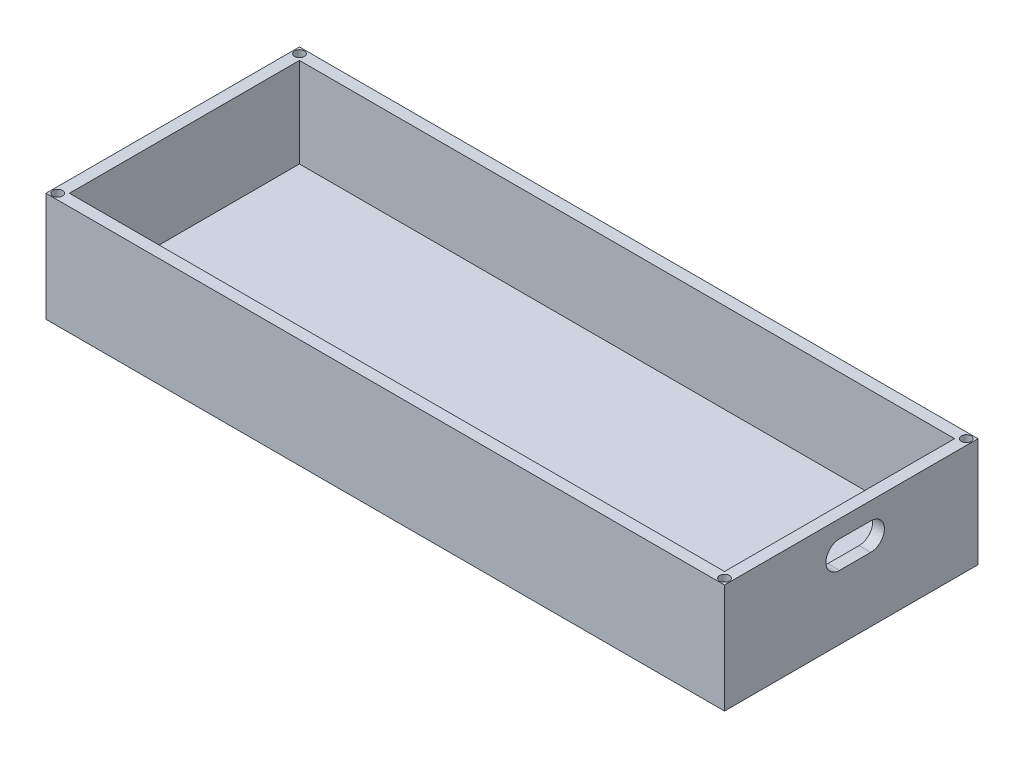
from build123d import *

# Parameters (mm, degrees)
SKETCH1_W           = 174
SKETCH1_H           = 65
BOSS_EXTRUDE1_DEPTH = 5
SKETCH2_W           = 174
SKETCH2_H           = 65
SKETCH2_W_2         = 168
SKETCH2_H_2         = 59
BOSS_EXTRUDE2_DEPTH = 23
CUT_EXTRUDE1_DEPTH  = 23
SKETCH4_R           = 1.25
CUT_EXTRUDE2_DEPTH  = 5


with BuildPart() as part:
    # Sketch1 → Boss-Extrude1 (new body)
    with BuildSketch(Plane(origin=(0, 0, 0), x_dir=(1, 0, 0), z_dir=(0, 1, 0))):
        Rectangle(SKETCH1_W, SKETCH1_H)
    extrude(amount=BOSS_EXTRUDE1_DEPTH)

    # Sketch2 → Boss-Extrude2 (add)
    with BuildSketch(Plane(origin=(0, 5, 0), x_dir=(1, 0, 0), z_dir=(0, 1, 0))):
        Rectangle(SKETCH2_W, SKETCH2_H)
        Rectangle(SKETCH2_W_2, SKETCH2_H_2, mode=Mode.SUBTRACT)
    extrude(amount=BOSS_EXTRUDE2_DEPTH)

    # Sketch3 → Cut-Extrude1 (cut)
    with BuildSketch(Plane(origin=(87, 0, 0), x_dir=(0, 0, -1), z_dir=(1, 0, 0))):
        with BuildLine():
            Line((-3, 23.5), (5, 23.5))
            ThreePointArc((5, 23.5), (8.5, 20), (5, 16.5))
            Line((5, 16.5), (-3, 16.5))
            ThreePointArc((-3, 16.5), (-6.5, 20), (-3, 23.5))
        make_face()
    extrude(amount=-CUT_EXTRUDE1_DEPTH, mode=Mode.SUBTRACT)

    # Sketch4 → Cut-Extrude2 (cut)
    with BuildSketch(Plane(origin=(0, 28, 0), x_dir=(1, 0, 0), z_dir=(0, 1, 0))):
        with Locations(Location((-85.5, 31, 0), (0, 0, 270))):
            Circle(SKETCH4_R)
        with Locations(Location((85.5, 31, 0), (0, 0, 270))):
            Circle(SKETCH4_R)
        with Locations(Location((85.5, -31, 0), (0, 0, 270))):
            Circle(SKETCH4_R)
        with Locations(Location((-85.5, -31, 0), (0, 0, 270))):
            Circle(SKETCH4_R)
    extrude(amount=-CUT_EXTRUDE2_DEPTH, mode=Mode.SUBTRACT)


solid = part.part
